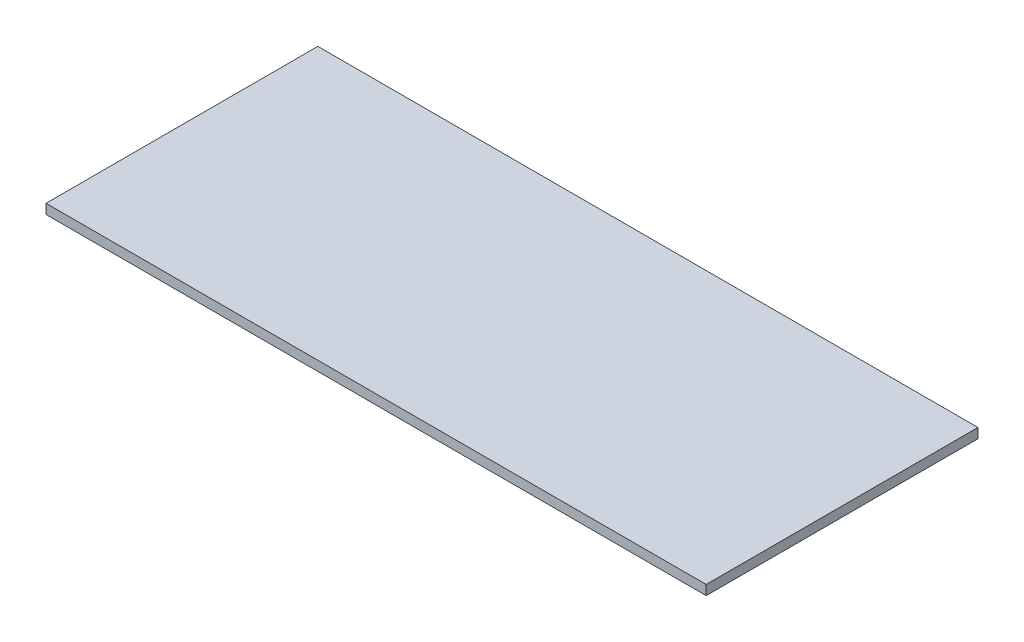
from build123d import *

# Parameters (mm, degrees)
CROQUIS1_W              = 680
CROQUIS1_H              = 280
SALIENTE_EXTRUIR1_DEPTH = 10


with BuildPart() as part:
    # Croquis1 → Saliente-Extruir1 (new body)
    with BuildSketch(Plane(origin=(0, 0, 0), x_dir=(1, 0, 0), z_dir=(0, 1, 0))):
        Rectangle(CROQUIS1_W, CROQUIS1_H)
    extrude(amount=SALIENTE_EXTRUIR1_DEPTH)


solid = part.part
